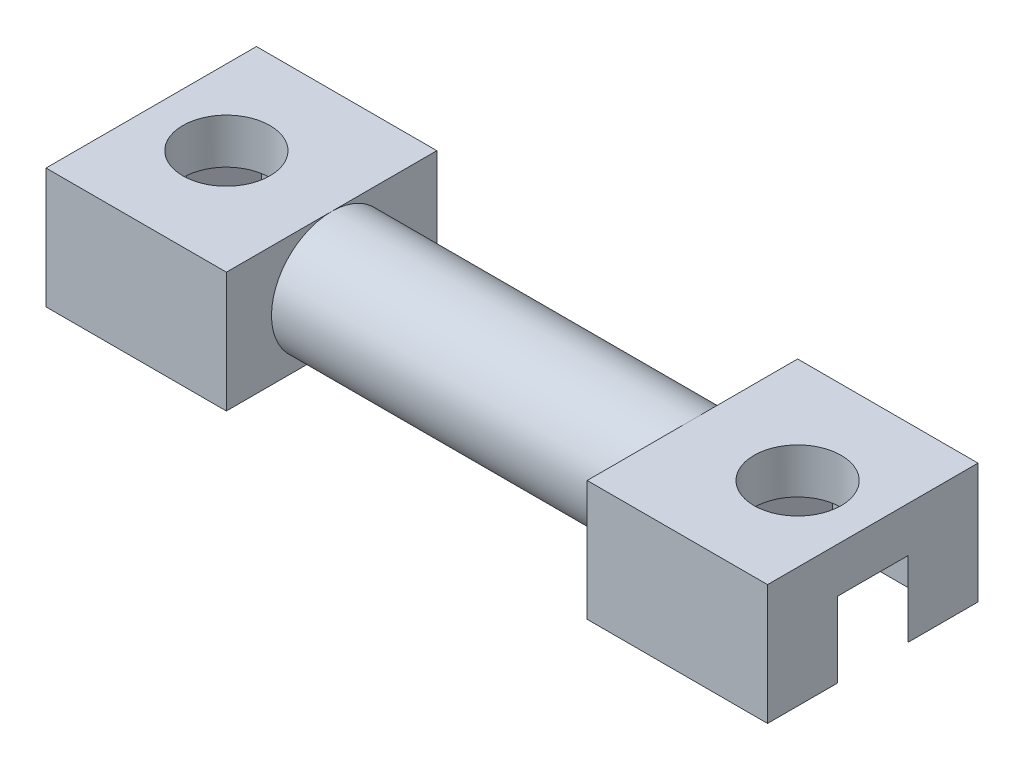
from build123d import *

# Parameters (mm, degrees)
SKETCH_1_W          = 24
SKETCH_1_H          = 7
SKETCH_1_R          = 1.45
EXTRUDE_1_DEPTH     = 4
CUT_EXTRUDE_1_DEPTH = 2.5
SKETCH_3_W          = 8.18570746
SKETCH_3_H          = 5.156071163
SKETCH_3_R          = 2
CUT_EXTRUDE_2_DEPTH = 6


with BuildPart() as part:
    # Эскиз1 → Бобышка-Вытянуть1 (new body)
    with BuildSketch(Plane(origin=(0, 0, 0), x_dir=(1, 0, 0), z_dir=(0, 1, 0))):
        Rectangle(SKETCH_1_W, SKETCH_1_H)
        with Locations(Location((-9.5, 0, 0), (0, 0, 270))):
            Circle(SKETCH_1_R, mode=Mode.SUBTRACT)
        with Locations(Location((9.5, 0, 0), (0, 0, 270))):
            Circle(SKETCH_1_R, mode=Mode.SUBTRACT)
    extrude(amount=EXTRUDE_1_DEPTH)

    # Эскиз2 → Вырез-Вытянуть1 (cut)
    with BuildSketch(Plane.XZ):
        Polygon((-7.91228676, 2.75), (-11.08771324, 2.75), (-12.675426481, 0), (-11.08771324, -2.75), (-7.91228676, -2.75), (-6.324573519, 0), align=None)
        Polygon((7.91228676, -2.75), (11.08771324, -2.75), (12.675426481, 0), (11.08771324, 2.75), (7.91228676, 2.75), (6.324573519, 0), align=None)
    extrude(amount=-CUT_EXTRUDE_1_DEPTH, mode=Mode.SUBTRACT)

    # Эскиз3 → Вырез-Вытянуть2 (cut, symmetric)
    with BuildSketch(Plane(origin=(0, 0, 0), x_dir=(0, 0, -1), z_dir=(1, 0, 0))):
        with Locations((0.188463291, 1.886210844)):
            Rectangle(SKETCH_3_W, SKETCH_3_H)
        with Locations(Location((0, 2, 0), (0, 0, 90))):
            Circle(SKETCH_3_R, mode=Mode.SUBTRACT)
    extrude(amount=CUT_EXTRUDE_2_DEPTH, both=True, mode=Mode.SUBTRACT)


solid = part.part
